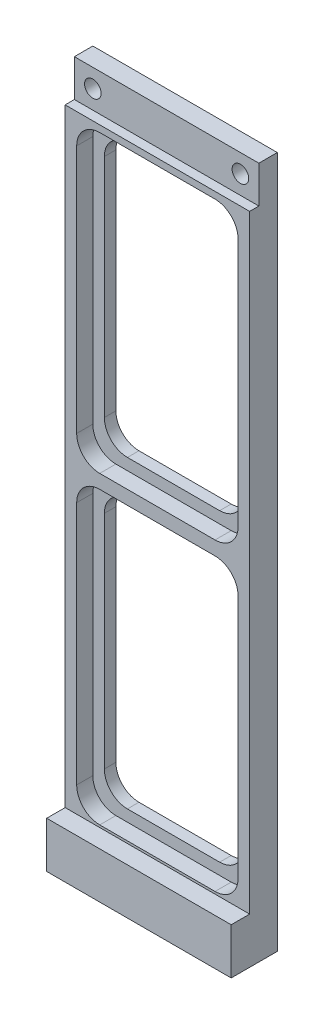
from build123d import *

# Parameters (mm, degrees)
SKETCH_1_W          = 40
SKETCH_1_H          = 150
EXTRUDE_1_DEPTH     = 6
SKETCH_3_W          = 30
SKETCH_3_H          = 59
SKETCH_3_H_2        = 58
CUT_EXTRUDE_2_DEPTH = 156.357651888
SKETCH_4_W          = 35
SKETCH_4_H          = 64
SKETCH_4_H_2        = 63
CUT_EXTRUDE_3_DEPTH = 3.5
FILLET_2_R          = 5
SKETCH_7_W          = 40
SKETCH_7_H          = 9.998672315
EXTRUDE_2_DEPTH     = 4
SKETCH_5_W          = 40
SKETCH_5_H          = 8.05
CUT_EXTRUDE_4_DEPTH = 2
SKETCH_8_R          = 2.4
CUT_EXTRUDE_5_DEPTH = 6
SKETCH_9_R          = 1.8
CUT_EXTRUDE_6_DEPTH = 156.357651888


with BuildPart() as part:
    # ｽｹｯﾁ1 → ﾎﾞｽ - 押し出し1 (new body)
    with BuildSketch(Plane.XY):
        with Locations((20, 75)):
            Rectangle(SKETCH_1_W, SKETCH_1_H)
    extrude(amount=EXTRUDE_1_DEPTH)

    # ｽｹｯﾁ3 → ｶｯﾄ - 押し出し2 (cut, through all)
    with BuildSketch(Plane.XY.offset(6)):
        with Locations((20, 108.5)):
            Rectangle(SKETCH_3_W, SKETCH_3_H)
        with Locations((20, 42)):
            Rectangle(SKETCH_3_W, SKETCH_3_H_2)
    extrude(amount=-CUT_EXTRUDE_2_DEPTH, mode=Mode.SUBTRACT)

    # ｽｹｯﾁ4 → ｶｯﾄ - 押し出し3 (cut)
    with BuildSketch(Plane.XY.offset(6)):
        with Locations((20, 108.5)):
            Rectangle(SKETCH_4_W, SKETCH_4_H)
        with Locations((20, 42)):
            Rectangle(SKETCH_4_W, SKETCH_4_H_2)
    extrude(amount=-CUT_EXTRUDE_3_DEPTH, mode=Mode.SUBTRACT)

    # ﾌｨﾚｯﾄ2
    fillet_2_edges = [part.edges().sort_by_distance(p)[0] for p in [
        (35, 138, 1.25),
        (35, 79, 1.25),
        (5, 79, 1.25),
        (5, 138, 1.25),
        (35, 71, 1.25),
        (35, 13, 1.25),
        (5, 13, 1.25),
        (5, 71, 1.25),
        (2.5, 76.5, 4.25),
        (2.5, 140.5, 4.25),
        (37.5, 140.5, 4.25),
        (37.5, 76.5, 4.25),
        (2.5, 10.5, 4.25),
        (2.5, 73.5, 4.25),
        (37.5, 73.5, 4.25),
        (37.5, 10.5, 4.25),
    ]]
    fillet(fillet_2_edges, radius=FILLET_2_R)

    # ｽｹｯﾁ7 → ﾎﾞｽ - 押し出し2 (add)
    with BuildSketch(Plane.XY.offset(6)):
        with Locations((20, 4.999336158)):
            Rectangle(SKETCH_7_W, SKETCH_7_H)
    extrude(amount=EXTRUDE_2_DEPTH)

    # ｽｹｯﾁ5 → ｶｯﾄ - 押し出し4 (cut)
    with BuildSketch(Plane.XY.offset(6)):
        with Locations((20, 145.975)):
            Rectangle(SKETCH_5_W, SKETCH_5_H)
    extrude(amount=-CUT_EXTRUDE_4_DEPTH, mode=Mode.SUBTRACT)

    # ｽｹｯﾁ8 → ｶｯﾄ - 押し出し5 (cut)
    with BuildSketch(Plane.XZ):
        with Locations(Location((5, 6, 0), (0, 0, 270))):
            Circle(SKETCH_8_R)
        with Locations(Location((25, 6, 0), (0, 0, 270))):
            Circle(SKETCH_8_R)
        with Locations(Location((35, 6, 0), (0, 0, 270))):
            Circle(SKETCH_8_R)
        with Locations(Location((15, 6, 0), (0, 0, 270))):
            Circle(SKETCH_8_R)
    extrude(amount=-CUT_EXTRUDE_5_DEPTH, mode=Mode.SUBTRACT)

    # ｽｹｯﾁ9 → ｶｯﾄ - 押し出し6 (cut, through all)
    with BuildSketch(Plane.XY.offset(4)):
        with Locations((4, 146)):
            Circle(SKETCH_9_R)
        with Locations((36, 146)):
            Circle(SKETCH_9_R)
    extrude(amount=-CUT_EXTRUDE_6_DEPTH, mode=Mode.SUBTRACT)


solid = part.part
